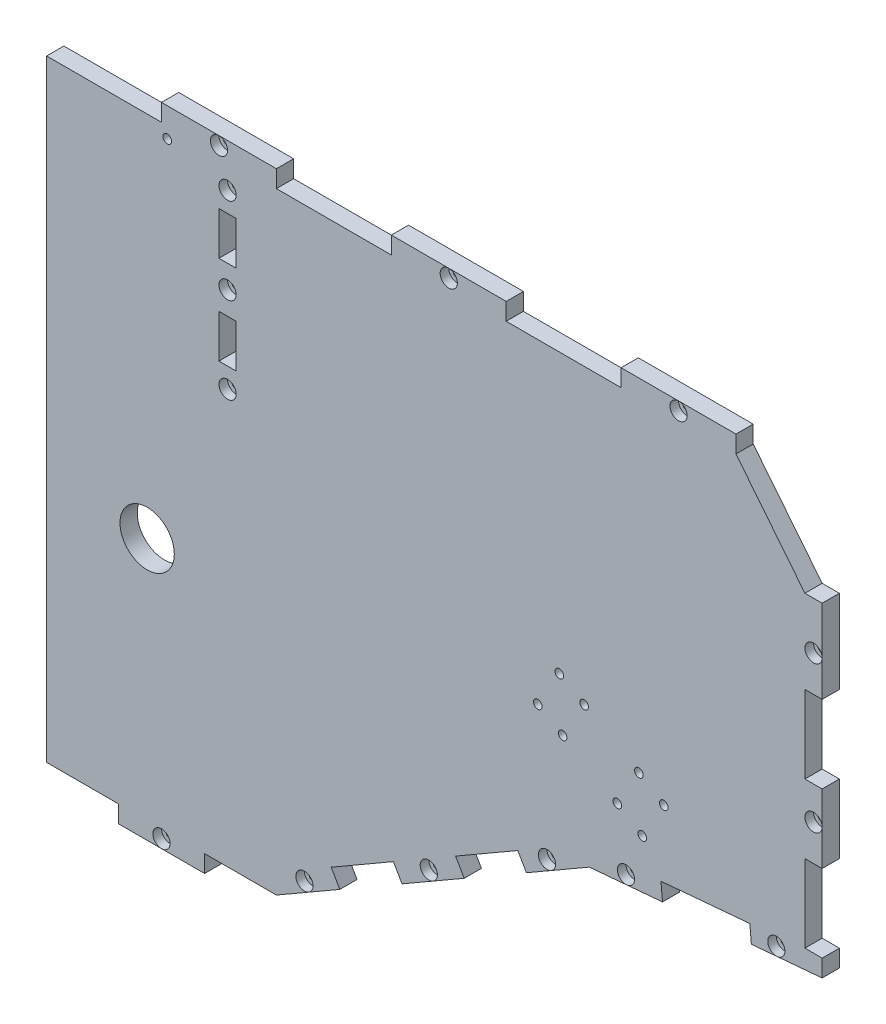
from build123d import *

# Parameters (mm, degrees)
ESQUISSE1_W                   = 270
ESQUISSE1_H                   = 213
BOSS_EXTRU_1_DEPTH            = 6
ESQUISSE3_R                   = 9.45
ESQUISSE3_R_2                 = 1.5
ENL_V_MAT_EXTRU_1_DEPTH       = 10
ENL_V_MAT_EXTRU_11_DEPTH      = 173.055950202
ENL_V_MAT_EXTRU_11_DEPTH_BACK = 173.055950202
ESQUISSE7_W                   = 6
ESQUISSE7_H                   = 30
ESQUISSE7_H_2                 = 27
ENL_V_MAT_EXTRU_13_DEPTH      = 10
ESQUISSE8_W                   = 40
ESQUISSE8_H                   = 6
BOSS_EXTRU_2_DEPTH            = 6
ENL_V_MAT_EXTRU_14_DEPTH      = 10
ENL_V_MAT_EXTRU_15_DEPTH      = 6
ESQUISSE11_W                  = 6
ESQUISSE11_H                  = 15
ENL_V_MAT_EXTRU_16_DEPTH      = 10
ESQUISSE14_W                  = 30
ESQUISSE14_H                  = 6
BOSS_EXTRU_3_DEPTH            = 6
ENL_V_MAT_EXTRU_18_DEPTH      = 176.833017377
ESQUISSE17_R                  = 2.995
ESQUISSE17_R_2                = 3
ENL_V_MAT_EXTRU_20_DEPTH      = 3
ESQUISSE18_R                  = 1.5
ENL_V_MAT_EXTRU_21_DEPTH      = 13


with BuildPart() as part:
    # Esquisse1 → Boss.-Extru.1 (new body)
    with BuildSketch(Plane.XY):
        Rectangle(ESQUISSE1_W, ESQUISSE1_H)
    extrude(amount=BOSS_EXTRU_1_DEPTH)

    # Esquisse3 → Enlèv. mat.-Extru.1 (cut)
    with BuildSketch(Plane.XY.offset(6)):
        with Locations((-100, -21.5)):
            Circle(ESQUISSE3_R)
        with Locations((35.99, -3.47)):
            Circle(ESQUISSE3_R_2)
        with Locations((43.49, 9.52)):
            Circle(ESQUISSE3_R_2)
        with Locations((44.65, -8.50726277)):
            Circle(ESQUISSE3_R_2)
        with Locations((52.15, 4.48273723)):
            Circle(ESQUISSE3_R_2)
        with Locations((71.2, -6.51726277)):
            Circle(ESQUISSE3_R_2)
        with Locations((63.7, -19.50726277)):
            Circle(ESQUISSE3_R_2)
        with Locations((72.36, -24.962747355)):
            Circle(ESQUISSE3_R_2)
        with Locations((79.86, -11.972747355)):
            Circle(ESQUISSE3_R_2)
    extrude(amount=-ENL_V_MAT_EXTRU_1_DEPTH, mode=Mode.SUBTRACT)

    # Esquisse5 → Enlèv. mat.-Extru.11 (cut, two sides: drawn at the far end of the back side and taken through both)
    with BuildSketch(Plane.XY.offset(6).offset(-ENL_V_MAT_EXTRU_11_DEPTH_BACK)):
        Polygon((135, -36.5), (53.963742643, -43.589753853), (-55, -106.5), (135, -106.5), align=None)
    extrude(amount=ENL_V_MAT_EXTRU_11_DEPTH + ENL_V_MAT_EXTRU_11_DEPTH_BACK, mode=Mode.SUBTRACT)

    # Esquisse7 → Enlèv. mat.-Extru.13 (cut)
    with BuildSketch(Plane.XY.offset(6)):
        with Locations((132, 91.5)):
            Rectangle(ESQUISSE7_W, ESQUISSE7_H)
        with Locations((132, -17)):
            Rectangle(ESQUISSE7_W, ESQUISSE7_H_2)
        with Locations((132, 34)):
            Rectangle(ESQUISSE7_W, ESQUISSE7_H_2)
    extrude(amount=-ENL_V_MAT_EXTRU_13_DEPTH, mode=Mode.SUBTRACT)

    # Esquisse8 → Boss.-Extru.2 (add)
    with BuildSketch(Plane(origin=(0, 106.5, 0), x_dir=(1, 0, 0), z_dir=(0, 1, 0))):
        with Locations((85, -3)):
            Rectangle(ESQUISSE8_W, ESQUISSE8_H)
        with Locations((5, -3)):
            Rectangle(ESQUISSE8_W, ESQUISSE8_H)
        with Locations((-75, -3)):
            Rectangle(ESQUISSE8_W, ESQUISSE8_H)
    extrude(amount=BOSS_EXTRU_2_DEPTH)

    # Esquisse9 → Enlèv. mat.-Extru.14 (cut)
    with BuildSketch(Plane(origin=(0, 0, 0), x_dir=(-1, 0, 0), z_dir=(0, 0, -1))):
        Polygon((-110.35, -38.656595556), (-79.413742643, -41.363167367), (-78.890808186, -35.385999178), (-109.827065544, -32.679427367), align=None)
    extrude(amount=-ENL_V_MAT_EXTRU_14_DEPTH, mode=Mode.SUBTRACT)

    # Esquisse10 → Enlèv. mat.-Extru.15 (cut)
    with BuildSketch(Plane(origin=(0, 0, 0), x_dir=(-1, 0, 0), z_dir=(0, 0, -1))):
        Polygon((-32.03555308, -56.25), (-10.384917986, -68.75), (-7.384917986, -63.553847577), (-29.03555308, -51.053847577), align=None)
        Polygon((11.265717109, -81.25), (32.916352203, -93.75), (35.916352203, -88.553847577), (14.265717109, -76.053847577), align=None)
    extrude(amount=-ENL_V_MAT_EXTRU_15_DEPTH, mode=Mode.SUBTRACT)

    # Esquisse11 → Enlèv. mat.-Extru.16 (cut)
    with BuildSketch(Plane(origin=(0, 0, 0), x_dir=(-1, 0, 0), z_dir=(0, 0, -1))):
        with Locations((72, 52)):
            Rectangle(ESQUISSE11_W, ESQUISSE11_H)
        with Locations((72, 83)):
            Rectangle(ESQUISSE11_W, ESQUISSE11_H)
    extrude(amount=-ENL_V_MAT_EXTRU_16_DEPTH, mode=Mode.SUBTRACT)

    # Esquisse14 → Boss.-Extru.3 (add)
    with BuildSketch(Plane.XZ.offset(106.5)):
        with Locations((-95, 3)):
            Rectangle(ESQUISSE14_W, ESQUISSE14_H)
    extrude(amount=BOSS_EXTRU_3_DEPTH)

    # Esquisse15 → Enlèv. mat.-Extru.18 (cut, through all)
    with BuildSketch(Plane.XY.offset(6)):
        Polygon((105, 106.5), (129, 106.5), (129, 76.5), align=None)
    extrude(amount=-ENL_V_MAT_EXTRU_18_DEPTH, mode=Mode.SUBTRACT)

    # Esquisse17 → Enlèv. mat.-Extru.20 (cut)
    with BuildSketch(Plane.XY.offset(6)):
        with Locations((-75, 109.5)):
            Circle(ESQUISSE17_R)
        with Locations((5, 109.5)):
            Circle(ESQUISSE17_R)
        with Locations((85, 109.5)):
            Circle(ESQUISSE17_R)
        with Locations((132, 60)):
            Circle(ESQUISSE17_R)
        with Locations((132, 9)):
            Circle(ESQUISSE17_R)
        with Locations((-1.940399562, -72.401923789)):
            Circle(ESQUISSE17_R)
        with Locations((119.054285055, -34.883609777)):
            Circle(ESQUISSE17_R)
        with Locations((66.699841688, -39.464030057)):
            Circle(ESQUISSE17_R)
        with Locations((-45.241669751, -97.401923789)):
            Circle(ESQUISSE17_R)
        with Locations((-95, -109.5)):
            Circle(ESQUISSE17_R)
        with Locations((39.195807118, -48.651923789)):
            Circle(ESQUISSE17_R)
        with Locations((-72, 67.5)):
            Circle(ESQUISSE17_R_2)
        with Locations((-72, 37.5)):
            Circle(ESQUISSE17_R_2)
        with Locations((-72, 97.5)):
            Circle(ESQUISSE17_R)
    extrude(amount=-ENL_V_MAT_EXTRU_20_DEPTH, mode=Mode.SUBTRACT)

    # Esquisse18 → Enlèv. mat.-Extru.21 (cut)
    with BuildSketch(Plane.XY.offset(6)):
        with Locations((-75, 109.5)):
            Circle(ESQUISSE18_R)
        with Locations((5, 109.5)):
            Circle(ESQUISSE18_R)
        with Locations((85, 109.5)):
            Circle(ESQUISSE18_R)
        with Locations((132, 60)):
            Circle(ESQUISSE18_R)
        with Locations((132, 9)):
            Circle(ESQUISSE18_R)
        with Locations((119.054285055, -34.883609777)):
            Circle(ESQUISSE18_R)
        with Locations((66.699841688, -39.464030057)):
            Circle(ESQUISSE18_R)
        with Locations((-1.940399562, -72.401923789)):
            Circle(ESQUISSE18_R)
        with Locations((-45.241669751, -97.401923789)):
            Circle(ESQUISSE18_R)
        with Locations((-72, 97.5)):
            Circle(ESQUISSE18_R)
        with Locations((-72, 67.5)):
            Circle(ESQUISSE18_R)
        with Locations((-72, 37.5)):
            Circle(ESQUISSE18_R)
        with Locations((-95, -109.5)):
            Circle(ESQUISSE18_R)
        with Locations((39.195807118, -48.651923789)):
            Circle(ESQUISSE18_R)
        with Locations((-93, 102.5)):
            Circle(ESQUISSE18_R)
    extrude(amount=-ENL_V_MAT_EXTRU_21_DEPTH, mode=Mode.SUBTRACT)


solid = part.part
